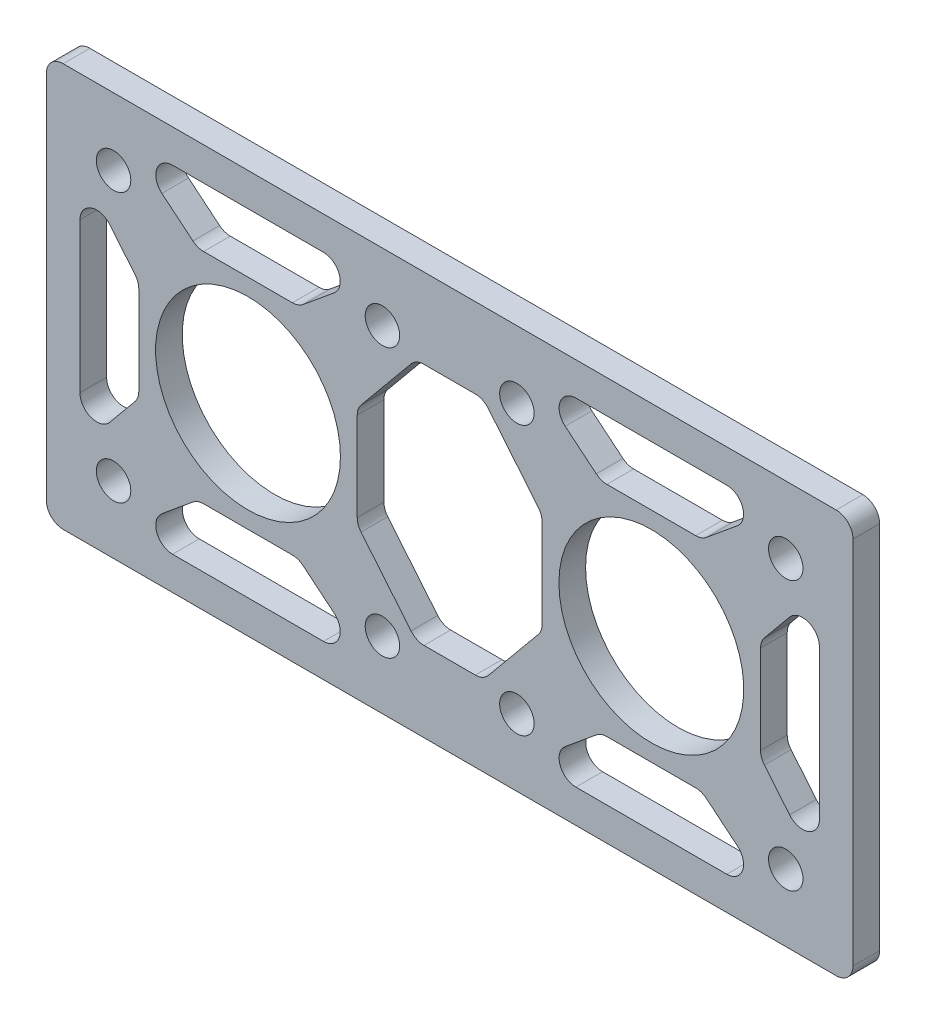
from build123d import *

# Parameters (mm, degrees)
SKETCH1_W           = 96
SKETCH1_H           = 48
SKETCH1_R           = 2.05
SKETCH1_R_2         = 11
BOSS_EXTRUDE1_DEPTH = 3.175
FILLET1_R           = 2


with BuildPart() as part:
    # Sketch1 → Boss-Extrude1 (new body)
    with BuildSketch(Plane.XY):
        Rectangle(SKETCH1_W, SKETCH1_H)
        with Locations((-40, 16)):
            Circle(SKETCH1_R, mode=Mode.SUBTRACT)
        with Locations((-8, 16)):
            Circle(SKETCH1_R, mode=Mode.SUBTRACT)
        with Locations((-8, -16)):
            Circle(SKETCH1_R, mode=Mode.SUBTRACT)
        with Locations((-40, -16)):
            Circle(SKETCH1_R, mode=Mode.SUBTRACT)
        with Locations((-24, 0)):
            Circle(SKETCH1_R_2, mode=Mode.SUBTRACT)
        with Locations(Location((8, 16, 0), (0, 0, 180))):
            Circle(SKETCH1_R, mode=Mode.SUBTRACT)
        with Locations(Location((8, -16, 0), (0, 0, 180))):
            Circle(SKETCH1_R, mode=Mode.SUBTRACT)
        with Locations(Location((40, -16, 0), (0, 0, 180))):
            Circle(SKETCH1_R, mode=Mode.SUBTRACT)
        with Locations(Location((24, 0, 0), (0, 0, 180))):
            Circle(SKETCH1_R_2, mode=Mode.SUBTRACT)
        with Locations(Location((40, 16, 0), (0, 0, 180))):
            Circle(SKETCH1_R, mode=Mode.SUBTRACT)
        Polygon((-38.544929421, 20.05), (-30, 13), (-18, 13), (-9.455070579, 20.05), align=None, mode=Mode.SUBTRACT)
        Polygon((-18, -13), (-9.455070579, -20.05), (-38.544929421, -20.05), (-30, -13), align=None, mode=Mode.SUBTRACT)
        Polygon((-11, -6), (-11, 6), (-4, 14.484327085), (4, 14.484327085), (11, 6), (11, -6), (4, -14.484327085), (-4, -14.484327085), align=None, mode=Mode.SUBTRACT)
        Polygon((30, -13), (18, -13), (9.455070579, -20.05), (38.544929421, -20.05), align=None, mode=Mode.SUBTRACT)
        Polygon((37, -6), (37, 6), (44, 14.484327085), (44, -14.484327085), align=None, mode=Mode.SUBTRACT)
        Polygon((18, 13), (9.455070579, 20.05), (38.544929421, 20.05), (30, 13), align=None, mode=Mode.SUBTRACT)
        Polygon((-44, -14.484327085), (-37, -6), (-37, 6), (-44, 14.484327085), align=None, mode=Mode.SUBTRACT)
    extrude(amount=BOSS_EXTRUDE1_DEPTH)

    # Fillet1
    fillet1_edges = [part.edges().sort_by_distance(p)[0] for p in [
        (38.544929421, -20.05, 1.5875),
        (30, -13, 1.5875),
        (18, -13, 1.5875),
        (9.455070579, -20.05, 1.5875),
        (37, -6, 1.5875),
        (44, -14.484327085, 1.5875),
        (44, 14.484327085, 1.5875),
        (37, 6, 1.5875),
        (18, 13, 1.5875),
        (30, 13, 1.5875),
        (38.544929421, 20.05, 1.5875),
        (9.455070579, 20.05, 1.5875),
        (-9.455070579, 20.05, 1.5875),
        (-38.544929421, 20.05, 1.5875),
        (-30, 13, 1.5875),
        (-18, 13, 1.5875),
        (-11, -6, 1.5875),
        (-4, -14.484327085, 1.5875),
        (4, -14.484327085, 1.5875),
        (11, -6, 1.5875),
        (11, 6, 1.5875),
        (4, 14.484327085, 1.5875),
        (-4, 14.484327085, 1.5875),
        (-11, 6, 1.5875),
        (-37, -6, 1.5875),
        (-37, 6, 1.5875),
        (-44, 14.484327085, 1.5875),
        (-44, -14.484327085, 1.5875),
        (-48, 24, 1.5875),
        (48, 24, 1.5875),
        (48, -24, 1.5875),
        (-48, -24, 1.5875),
        (-18, -13, 1.5875),
        (-30, -13, 1.5875),
        (-38.544929421, -20.05, 1.5875),
        (-9.455070579, -20.05, 1.5875),
    ]]
    fillet(fillet1_edges, radius=FILLET1_R)


solid = part.part
